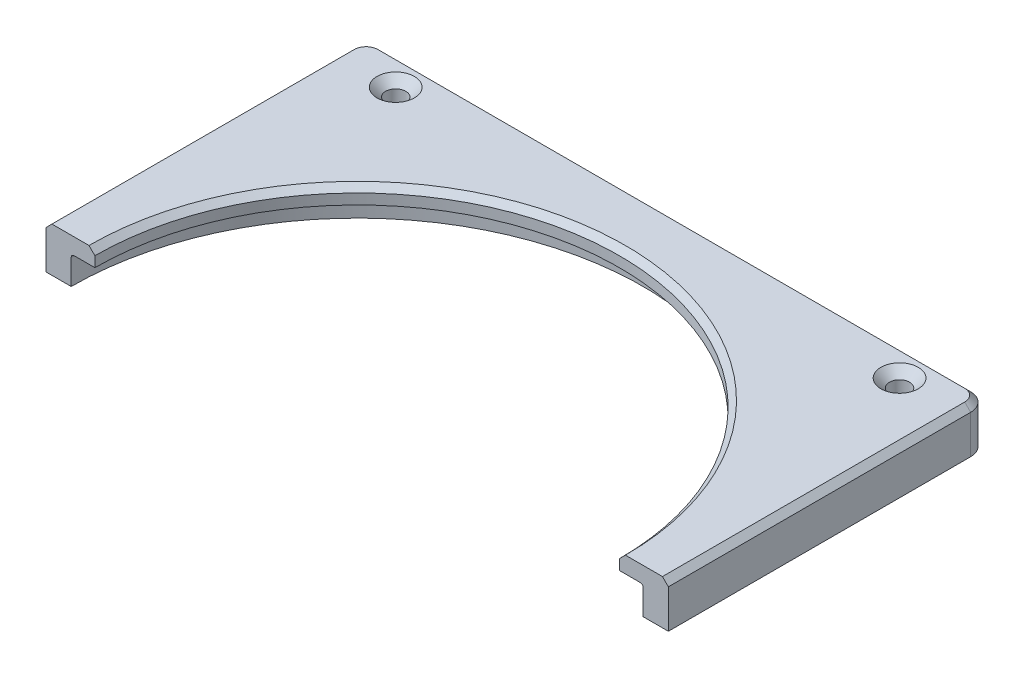
from build123d import *

# Parameters (mm, degrees)
SKETCH1_W                                      = 105
SKETCH1_H                                      = 54
BOSS_EXTRUDE2_DEPTH                            = 7.5
SKETCH2_R                                      = 48.25
CUT_EXTRUDE1_DEPTH                             = 4.75
SKETCH3_R                                      = 44.25
CUT_EXTRUDE2_DEPTH                             = 60.510503275
CSK_FOR_M3_FLAT_HEAD_MACHINE_SCREW1_AT_2_COUNT = 2
CSK_FOR_M3_FLAT_HEAD_MACHINE_SCREW1_AT_2_PITCH = 85
FILLET1_R                                      = 3
CHAMFER1_SIZE                                  = 1
FILLET2_R                                      = 0.5


with BuildPart() as part:
    # Sketch1 → Boss-Extrude2 (new body)
    with BuildSketch(Plane(origin=(0, 0, 0), x_dir=(1, 0, 0), z_dir=(0, 1, 0))):
        Rectangle(SKETCH1_W, SKETCH1_H)
    extrude(amount=BOSS_EXTRUDE2_DEPTH)

    # Sketch2 → Cut-Extrude1 (cut)
    with BuildSketch(Plane.XZ):
        with Locations((0, 27)):
            Circle(SKETCH2_R)
    extrude(amount=-CUT_EXTRUDE1_DEPTH, mode=Mode.SUBTRACT)

    # Sketch3 → Cut-Extrude2 (cut, through all)
    with BuildSketch(Plane(origin=(0, 7.5, 0), x_dir=(1, 0, 0), z_dir=(0, 1, 0))):
        with Locations((0, -27)):
            Circle(SKETCH3_R)
    extrude(amount=-CUT_EXTRUDE2_DEPTH, mode=Mode.SUBTRACT)

    # Sketch5 → CSK for M3 Flat Head Machine Screw1 (revolve, cut)
    with BuildSketch(Plane(origin=(-42.5, 7.5, -22), x_dir=(0, 0, 1), z_dir=(1, 0, 0))):
        Polygon((0, 0), (0, 7.5), (2.2, 7.5), (1.7, 7), (1.7, 1.45), (3.15, 0), align=None)
    csk_for_m3_flat_head_machine_screw1 = revolve(axis=Axis((-42.5, 13.85, -22), (0, -1, 0)), mode=Mode.SUBTRACT)

    # CSK for M3 Flat Head Machine Screw1 at 2: CSK for M3 Flat Head Machine Screw1 ×2
    with Locations(*[(i * CSK_FOR_M3_FLAT_HEAD_MACHINE_SCREW1_AT_2_PITCH, 0, 0) for i in range(1, CSK_FOR_M3_FLAT_HEAD_MACHINE_SCREW1_AT_2_COUNT)]):
        add(csk_for_m3_flat_head_machine_screw1, mode=Mode.SUBTRACT)

    # Fillet1
    fillet1_edges = [part.edges().sort_by_distance(p)[0] for p in [
        (-52.5, 3.75, -27),
        (52.5, 3.75, -27),
    ]]
    fillet(fillet1_edges, radius=FILLET1_R)

    # Chamfer1
    chamfer1_edges = [part.edges().sort_by_distance(p)[0] for p in [
        (0, 7.5, -17.25),
        (52.5, 7.5, 1.5),
        (-52.5, 7.5, 1.5),
        (0, 7.5, -27),
        (51.621320344, 7.5, -26.121320344),
        (-51.621320344, 7.5, -26.121320344),
    ]]
    chamfer(chamfer1_edges, length=CHAMFER1_SIZE)

    # Fillet2
    fillet2_edges = [part.edges().sort_by_distance(p)[0] for p in [
        (0, 4.75, -21.25),
    ]]
    fillet(fillet2_edges, radius=FILLET2_R)


solid = part.part
